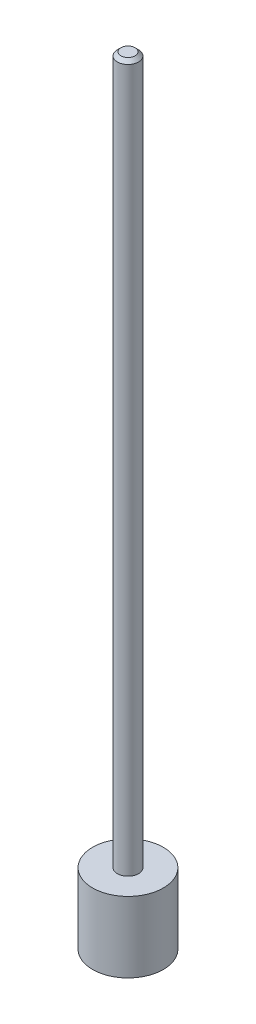
from build123d import *

# Parameters (mm, degrees)
SKETCH1_R           = 5
BOSS_EXTRUDE1_DEPTH = 10
SKETCH2_R           = 1.5
BOSS_EXTRUDE2_DEPTH = 100
CHAMFER1_SIZE       = 0.5


with BuildPart() as part:
    # Sketch1 → Boss-Extrude1 (new body)
    with BuildSketch(Plane(origin=(0, 0, 0), x_dir=(1, 0, 0), z_dir=(0, 1, 0))):
        with Locations(Location((0, 0, 0), (0, 0, 270))):
            Circle(SKETCH1_R)
    extrude(amount=BOSS_EXTRUDE1_DEPTH)

    # Sketch2 → Boss-Extrude2 (add)
    with BuildSketch(Plane(origin=(0, 10, 0), x_dir=(1, 0, 0), z_dir=(0, 1, 0))):
        with Locations(Location((0, 0, 0), (0, 0, 270))):
            Circle(SKETCH2_R)
    extrude(amount=BOSS_EXTRUDE2_DEPTH)

    # Chamfer1
    chamfer1_edges = [part.edges().sort_by_distance(p)[0] for p in [
        (0, 110, -1.5),
    ]]
    chamfer(chamfer1_edges, length=CHAMFER1_SIZE)


solid = part.part
